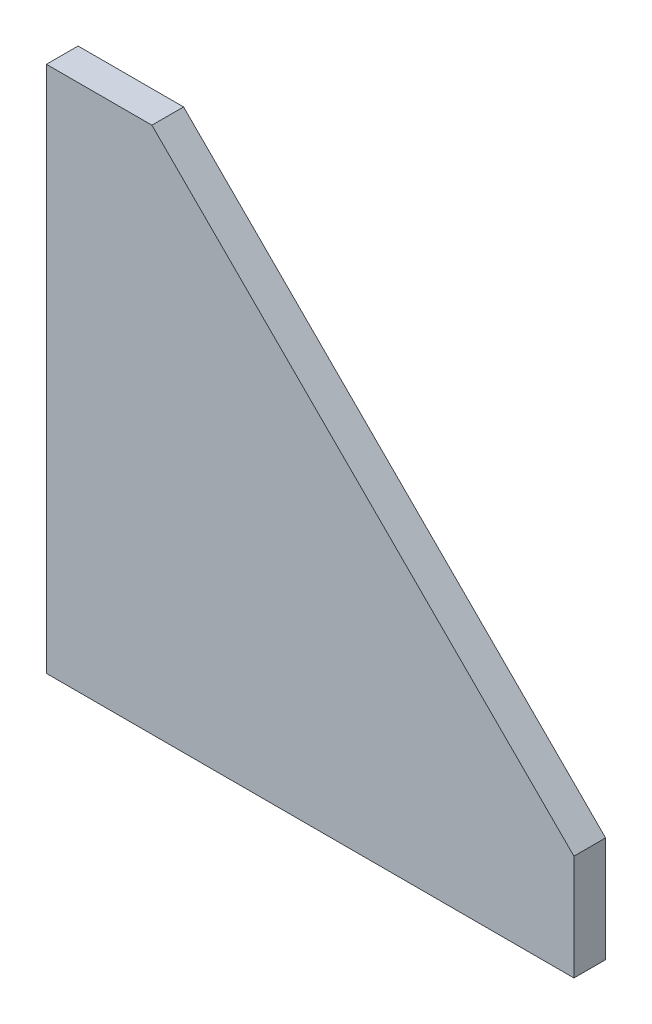
from build123d import *

# Parameters (mm, degrees)
EXTRUDE_1_DEPTH = 3


with BuildPart() as part:
    # 草图1 → 凸台-拉伸1 (new body)
    with BuildSketch(Plane.XY):
        Polygon((0, 0), (0, 50), (10, 50), (50, 10), (50, 0), align=None)
    extrude(amount=EXTRUDE_1_DEPTH)


solid = part.part
